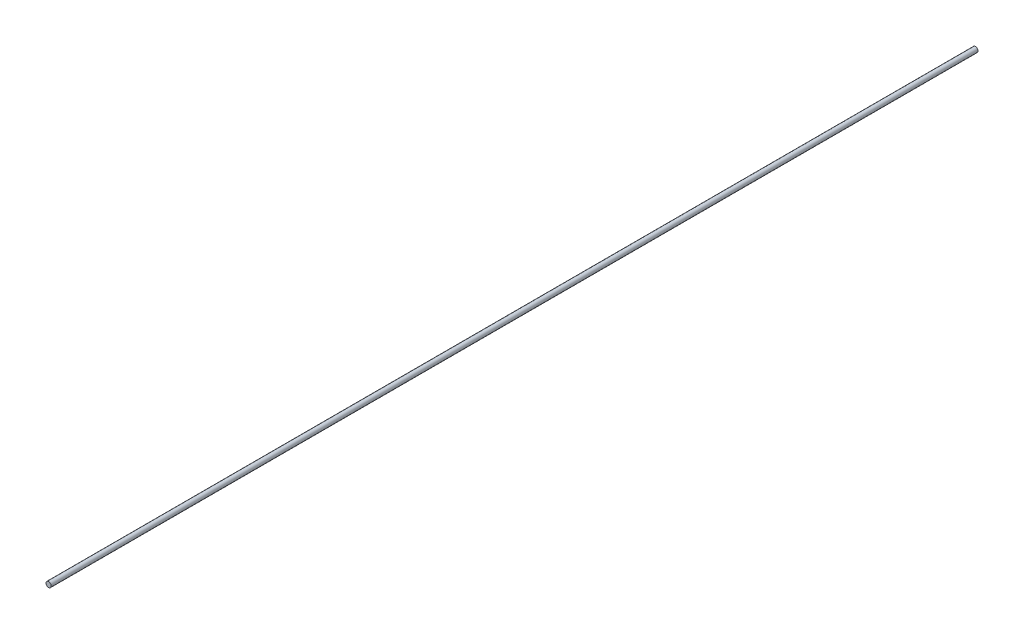
from build123d import *

# Parameters (mm, degrees)
SKETCH1_R           = 1
BOSS_EXTRUDE1_DEPTH = 360


with BuildPart() as part:
    # Sketch1 → Boss-Extrude1 (new body)
    with BuildSketch(Plane.XY):
        Circle(SKETCH1_R)
    extrude(amount=BOSS_EXTRUDE1_DEPTH)


solid = part.part
